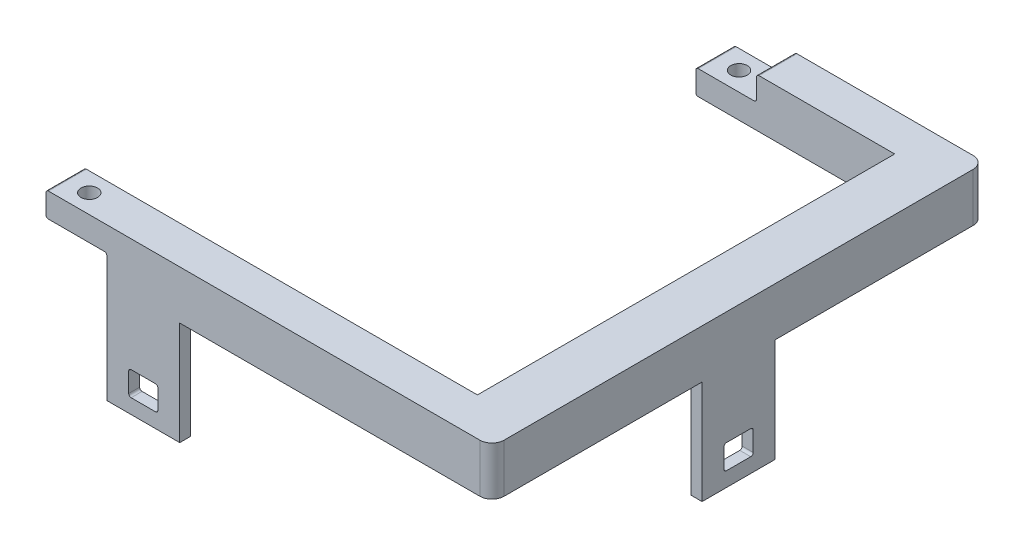
from build123d import *

# Parameters (mm, degrees)
SKETCH1_W            = 143.4
SKETCH1_H            = 101.4
BOSS_EXTRUDE1_DEPTH  = 10
SKETCH2_W            = 121.8
SKETCH2_H            = 85.8
CUT_EXTRUDE1_DEPTH   = 89.382011744
CUT_EXTRUDE2_DEPTH   = 89.382011744
SKETCH4_W            = 2.25
SKETCH4_H            = 15
SKETCH4_W_2          = 15
SKETCH4_H_2          = 2.25
BOSS_EXTRUDE2_DEPTH  = 21.3
SKETCH5_W            = 6
SKETCH5_H            = 5
CUT_EXTRUDE3_DEPTH   = 107.925534836
SKETCH6_W            = 6
SKETCH6_H            = 5
CUT_EXTRUDE4_DEPTH   = 127.002142839
M3_CLEARANCE_HOLE1_D = 3.4
SKETCH10_W           = 12.5
SKETCH10_H           = 5
CUT_EXTRUDE5_DEPTH   = 127.002142839
CUT_EXTRUDE6_REACH   = 128.002
SKETCH11_W           = 12.5
SKETCH11_H           = 5
FILLET1_R            = 2.5
FILLET2_R            = 0.5
FILLET3_R            = 1
FILLET4_R            = 0.5


with BuildPart() as part:
    # Sketch1 → Boss-Extrude1 (new body)
    with BuildSketch(Plane(origin=(0, 0, 0), x_dir=(1, 0, 0), z_dir=(0, 1, 0))):
        Rectangle(SKETCH1_W, SKETCH1_H)
    extrude(amount=BOSS_EXTRUDE1_DEPTH)

    # Sketch2 → Cut-Extrude1 (cut, through all)
    with BuildSketch(Plane.XZ):
        Rectangle(SKETCH2_W, SKETCH2_H)
    extrude(amount=-CUT_EXTRUDE1_DEPTH, mode=Mode.SUBTRACT)

    # Sketch3 → Cut-Extrude2 (cut, through all)
    with BuildSketch(Plane.XZ):
        Polygon((-20, 50.7), (-20, 42.9), (-60.9, 42.9), (-60.9, -42.9), (20, -42.9), (20, -50.7), (-71.7, -50.7), (-71.7, 50.7), align=None)
    extrude(amount=-CUT_EXTRUDE2_DEPTH, mode=Mode.SUBTRACT)

    # Sketch4 → Boss-Extrude2 (add)
    with BuildSketch(Plane.XZ):
        with Locations((70.575, 0)):
            Rectangle(SKETCH4_W, SKETCH4_H)
        with Locations((0, 49.575)):
            Rectangle(SKETCH4_W_2, SKETCH4_H_2)
    extrude(amount=BOSS_EXTRUDE2_DEPTH)

    # Sketch5 → Cut-Extrude3 (cut, through all)
    with BuildSketch(Plane(origin=(71.7, 0, 0), x_dir=(0, 0, -1), z_dir=(1, 0, 0))):
        with Locations((0, -15.8)):
            Rectangle(SKETCH5_W, SKETCH5_H)
    extrude(amount=-CUT_EXTRUDE3_DEPTH, mode=Mode.SUBTRACT)

    # Sketch6 → Cut-Extrude4 (cut, through all)
    with BuildSketch(Plane.XY.offset(50.7)):
        with Locations((0, -15.8)):
            Rectangle(SKETCH6_W, SKETCH6_H)
    extrude(amount=-CUT_EXTRUDE4_DEPTH, mode=Mode.SUBTRACT)

    # M3 Clearance Hole1 (through all)
    with Locations(Plane(origin=(0, 10, 0), x_dir=(1, 0, 0), z_dir=(0, 1, 0))):
        with Locations((-15, -46.8), (25, 46.8)):
            Hole(M3_CLEARANCE_HOLE1_D / 2)

    # Sketch10 → Cut-Extrude5 (cut, through all)
    with BuildSketch(Plane.XY.offset(50.7)):
        with Locations((-13.75, 2.5)):
            Rectangle(SKETCH10_W, SKETCH10_H)
    extrude(amount=-CUT_EXTRUDE5_DEPTH, mode=Mode.SUBTRACT)

    # Sketch11 → Cut-Extrude6 (cut, up to next)
    with BuildSketch(Plane(origin=(0, 0, -50.7), x_dir=(-1, 0, 0), z_dir=(0, 0, -1)), mode=Mode.PRIVATE) as cut_extrude6_sk1:
        with Locations((-26.25, 7.5)):
            Rectangle(SKETCH11_W, SKETCH11_H)
    cut_extrude6_tool1 = extrude(cut_extrude6_sk1.sketch, amount=-CUT_EXTRUDE6_REACH, mode=Mode.PRIVATE) & part.part
    add(cut_extrude6_tool1.solids().sort_by_distance((26.25, 7.5, -50.7))[0], mode=Mode.SUBTRACT)

    # Fillet1
    fillet1_edges = [part.edges().sort_by_distance(p)[0] for p in [
        (71.7, 5, -50.7),
        (71.7, 5, 50.7),
    ]]
    fillet(fillet1_edges, radius=FILLET1_R)

    # Fillet2
    fillet2_edges = [part.edges().sort_by_distance(p)[0] for p in [
        (-7.5, 5, 46.8),
        (-20, 5, 46.8),
        (32.5, 10, -46.8),
        (32.5, 5, -46.8),
        (20, 5, -46.8),
        (-20, 10, 46.8),
        (20, 0, -46.8),
    ]]
    fillet(fillet2_edges, radius=FILLET2_R)

    # Fillet3
    fillet3_edges = [part.edges().sort_by_distance(p)[0] for p in [
        (69.45, 0, 0),
        (0, 0, 48.45),
    ]]
    fillet(fillet3_edges, radius=FILLET3_R)

    # Fillet4
    fillet4_edges = [part.edges().sort_by_distance(p)[0] for p in [
        (3, -13.3, 49.575),
        (3, -18.3, 49.575),
        (-3, -18.3, 49.575),
        (-3, -13.3, 49.575),
        (70.575, -13.3, -3),
        (70.575, -18.3, -3),
        (70.575, -18.3, 3),
        (70.575, -13.3, 3),
    ]]
    fillet(fillet4_edges, radius=FILLET4_R)


solid = part.part
